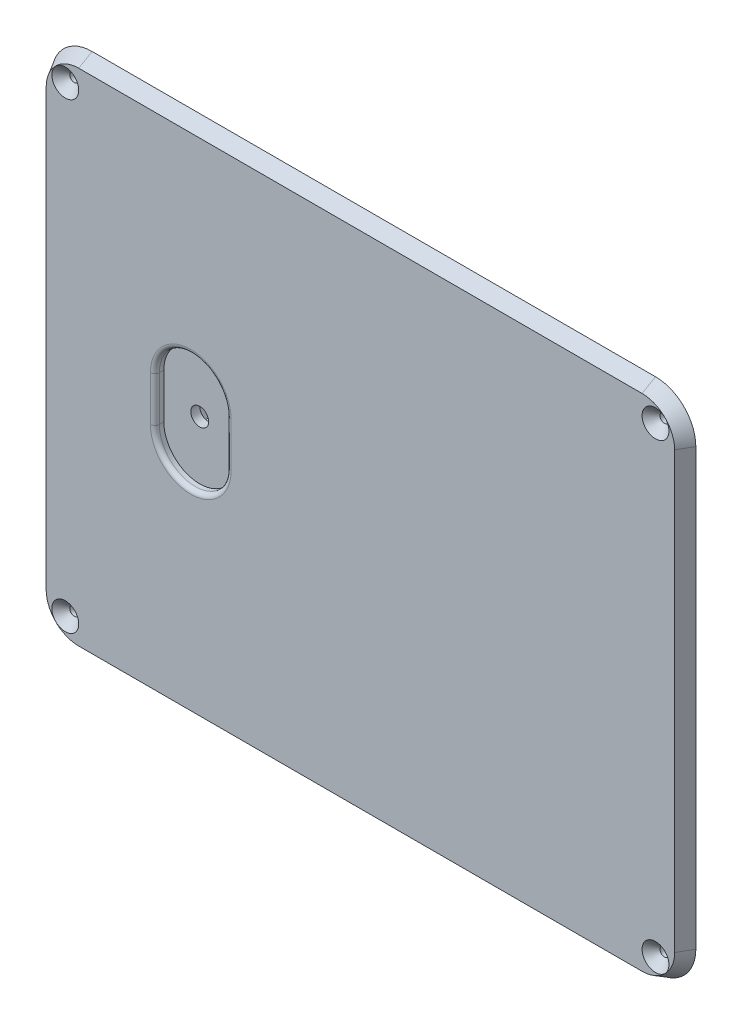
from build123d import *

# Parameters (mm, degrees)
EXTRUDE_1_DEPTH     = 3
EXTRUDE_1_TAPER     = 30
SKETCH_10_R         = 1
CUT_EXTRUDE_1_DEPTH = 10
CHAMFER_1_SIZE      = 2
EXTRUDE_2_DEPTH     = 1
EXTRUDE_2_TAPER     = 6
SKETCH_17_R         = 2.5
CUT_EXTRUDE_4_DEPTH = 2.4
CUT_EXTRUDE_2_DEPTH = 2
FILLET_1_R          = 1
SKETCH_13_R         = 2
CUT_EXTRUDE_3_DEPTH = 5220.265354769
SKETCH_14_R         = 14.5
EXTRUDE_3_DEPTH     = 3.2
FILLET_2_R          = 2


with BuildPart() as part:
    # Эскиз2 → Бобышка-Вытянуть1 (new body)
    with BuildSketch(Plane.XY):
        with BuildLine():
            ThreePointArc((4305.330098813, -2844.244902344), (4302.694059844, -2837.880941313), (4296.330098813, -2835.244902344))
            Line((4296.330098813, -2835.244902344), (4170.600097656, -2835.244902344))
            ThreePointArc((4170.600097656, -2835.244902344), (4164.236136626, -2837.880941313), (4161.600097656, -2844.244902344))
            Line((4161.600097656, -2844.244902344), (4161.600097656, -2941.399902344))
            ThreePointArc((4161.600097656, -2941.399902344), (4164.236136626, -2947.763863374), (4170.600097656, -2950.399902344))
            Line((4170.600097656, -2950.399902344), (4296.330098813, -2950.399902344))
            ThreePointArc((4296.330098813, -2950.399902344), (4302.694059844, -2947.763863374), (4305.330098813, -2941.399902344))
            Line((4305.330098813, -2941.399902344), (4305.330098813, -2844.244902344))
        make_face()
    extrude(amount=EXTRUDE_1_DEPTH, taper=EXTRUDE_1_TAPER)

    # Эскиз10 → Вырез-Вытянуть1 (cut)
    with BuildSketch(Plane.XY.offset(3)):
        with Locations((4167.600097656, -2841.244902344)):
            Circle(SKETCH_10_R)
        with Locations((4299.330098813, -2841.244902344)):
            Circle(SKETCH_10_R)
        with Locations((4167.600097656, -2944.399902344)):
            Circle(SKETCH_10_R)
        with Locations((4299.330098813, -2944.399902344)):
            Circle(SKETCH_10_R)
    extrude(amount=-CUT_EXTRUDE_1_DEPTH, mode=Mode.SUBTRACT)

    # Фаска1
    chamfer_1_edges = [part.edges().sort_by_distance(p)[0] for p in [
        (4298.330098813, -2841.244902344, 3),
        (4166.600097656, -2944.399902344, 3),
        (4298.330098813, -2944.399902344, 3),
        (4166.600097656, -2841.244902344, 3),
    ]]
    chamfer(chamfer_1_edges, length=CHAMFER_1_SIZE)

    # Эскиз11 → Бобышка-Вытянуть2 (add)
    with BuildSketch(Plane(origin=(0, 0, 0), x_dir=(-1, 0, 0), z_dir=(0, 0, -1))):
        with BuildLine():
            Line((-4301.330098813, -2846.244902344), (-4301.330098813, -2939.399902344))
            Line((-4301.330098813, -2939.399902344), (-4299.330098813, -2939.399902344))
            ThreePointArc((-4299.330098813, -2939.399902344), (-4295.794564907, -2940.864368438), (-4294.330098813, -2944.399902344))
            Line((-4294.330098813, -2944.399902344), (-4294.330098813, -2946.399902344))
            Line((-4294.330098813, -2946.399902344), (-4172.600097656, -2946.399902344))
            Line((-4172.600097656, -2946.399902344), (-4172.600097656, -2944.399902344))
            ThreePointArc((-4172.600097656, -2944.399902344), (-4171.135631562, -2940.864368438), (-4167.600097656, -2939.399902344))
            Line((-4167.600097656, -2939.399902344), (-4165.600097656, -2939.399902344))
            Line((-4165.600097656, -2939.399902344), (-4165.600097656, -2846.244902344))
            Line((-4165.600097656, -2846.244902344), (-4167.600097656, -2846.244902344))
            ThreePointArc((-4167.600097656, -2846.244902344), (-4171.135631562, -2844.78043625), (-4172.600097656, -2841.244902344))
            Line((-4172.600097656, -2841.244902344), (-4172.600097656, -2839.244902344))
            Line((-4172.600097656, -2839.244902344), (-4294.330098813, -2839.244902344))
            Line((-4294.330098813, -2839.244902344), (-4294.330098813, -2841.244902344))
            ThreePointArc((-4294.330098813, -2841.244902344), (-4295.794564907, -2844.78043625), (-4299.330098813, -2846.244902344))
            Line((-4299.330098813, -2846.244902344), (-4301.330098813, -2846.244902344))
        make_face()
    extrude(amount=EXTRUDE_2_DEPTH, taper=EXTRUDE_2_TAPER)

    # Эскиз17 → Вырез-Вытянуть4 (cut)
    with BuildSketch(Plane(origin=(0, 0, -1), x_dir=(-1, 0, 0), z_dir=(0, 0, -1))):
        with Locations((-4172.600097656, -2871.079902344)):
            Circle(SKETCH_17_R)
        with Locations((-4172.600097656, -2876.199902344)):
            Circle(SKETCH_17_R)
        with Locations((-4172.600097656, -2881.319902344)):
            Circle(SKETCH_17_R)
        with Locations((-4172.600097656, -2886.439902344)):
            Circle(SKETCH_17_R)
        with Locations((-4172.600097656, -2891.559902344)):
            Circle(SKETCH_17_R)
        with Locations((-4172.600097656, -2896.679902344)):
            Circle(SKETCH_17_R)
        with Locations((-4172.600097656, -2901.799902344)):
            Circle(SKETCH_17_R)
        with Locations((-4172.600097656, -2906.919902344)):
            Circle(SKETCH_17_R)
        with Locations((-4172.600097656, -2912.039902344)):
            Circle(SKETCH_17_R)
        with Locations((-4172.600097656, -2917.159902344)):
            Circle(SKETCH_17_R)
        with Locations((-4172.600097656, -2922.279902344)):
            Circle(SKETCH_17_R)
        with Locations((-4172.600097656, -2927.399902344)):
            Circle(SKETCH_17_R)
    extrude(amount=-CUT_EXTRUDE_4_DEPTH, mode=Mode.SUBTRACT)

    # Эскиз12 → Вырез-Вытянуть2 (cut)
    with BuildSketch(Plane.XY.offset(3)):
        with BuildLine():
            Line((4187.60009722, -2897.822402344), (4187.60009722, -2887.822402344))
            ThreePointArc((4187.60009722, -2887.822402344), (4195.60009722, -2879.822402344), (4203.60009722, -2887.822402344))
            Line((4203.60009722, -2887.822402344), (4203.60009722, -2897.822402344))
            ThreePointArc((4203.60009722, -2897.822402344), (4195.60009722, -2905.822402344), (4187.60009722, -2897.822402344))
        make_face()
    extrude(amount=-CUT_EXTRUDE_2_DEPTH, mode=Mode.SUBTRACT)

    # Скругление1
    fillet_1_edges = [part.edges().sort_by_distance(p)[0] for p in [
        (4195.60009722, -2905.822402344, 3),
        (4203.60009722, -2892.822402344, 3),
        (4195.60009722, -2879.822402344, 3),
        (4187.60009722, -2892.822402344, 3),
    ]]
    fillet(fillet_1_edges, radius=FILLET_1_R)

    # Эскиз13 → Вырез-Вытянуть3 (cut, through all)
    with BuildSketch(Plane.XY.offset(1)):
        with Locations((4195.60009722, -2892.822402344)):
            Circle(SKETCH_13_R)
    extrude(amount=-CUT_EXTRUDE_3_DEPTH, mode=Mode.SUBTRACT)

    # Эскиз14 → Бобышка-Вытянуть3 (add)
    with BuildSketch(Plane(origin=(0, 0, -1), x_dir=(-1, 0, 0), z_dir=(0, 0, -1))):
        with Locations((-4195.60009722, -2892.822402344)):
            Circle(SKETCH_14_R)
        Polygon((-4193.726947304, -2889.24125131), (-4197.764890032, -2889.409631415), (-4199.638039948, -2892.990782448), (-4197.473247136, -2896.403553377), (-4193.435304408, -2896.235173273), (-4191.562154492, -2892.654022239), align=None, mode=Mode.SUBTRACT)
    extrude(amount=EXTRUDE_3_DEPTH)

    # Скругление2
    fillet_2_edges = [part.edges().sort_by_distance(p)[0] for p in [
        (4210.10009722, -2892.822402344, -4.2),
    ]]
    fillet(fillet_2_edges, radius=FILLET_2_R)


solid = part.part
